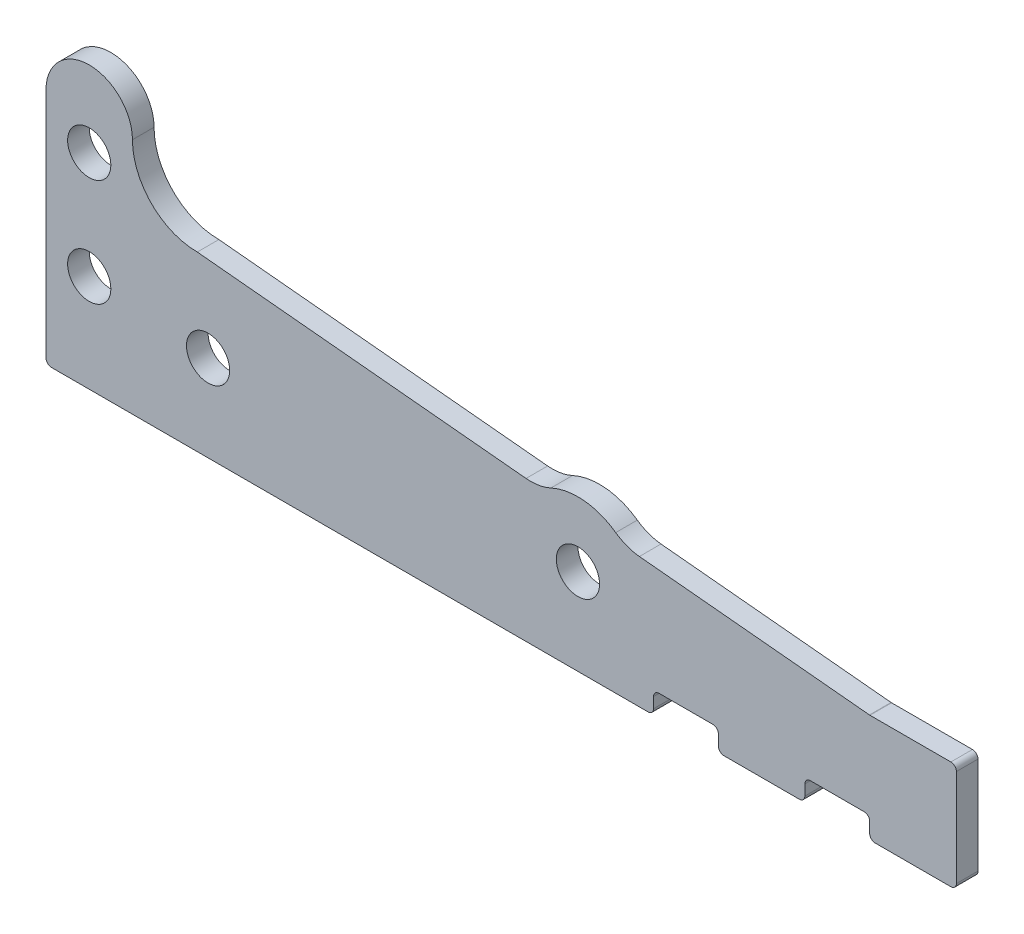
from build123d import *

# Parameters (mm, degrees)
SKETCH1_R           = 1.5875
BOSS_EXTRUDE1_DEPTH = 1.5875
FILLET1_R           = 0.4064
FILLET2_R           = 3.571875


with BuildPart() as part:
    # Sketch1 → Boss-Extrude1 (new body)
    with BuildSketch(Plane.XY):
        with BuildLine():
            Line((0, -1.5875), (44.63290286, -1.5875))
            Line((44.63290286, -1.5875), (44.63290286, 0))
            Line((44.63290286, 0), (49.39540286, 0))
            Line((49.39540286, 0), (49.39540286, -1.5875))
            Line((49.39540286, -1.5875), (55.74540286, -1.5875))
            Line((55.74540286, -1.5875), (55.74540286, 0))
            Line((55.74540286, 0), (60.50790286, 0))
            Line((60.50790286, 0), (60.50790286, -1.5875))
            Line((60.50790286, -1.5875), (66.87666203, -1.5875))
            Line((66.87666203, -1.5875), (66.87666203, 6.35))
            Line((66.87666203, 6.35), (60.50790286, 6.35))
            Line((60.50790286, 6.35), (42.486240722, 8.087573964))
            ThreePointArc((42.486240722, 8.087573964), (39.53371386, 9.503017007), (36.365146493, 8.677744497))
            Line((36.365146493, 8.677744497), (11.1125, 11.1125))
            ThreePointArc((11.1125, 11.1125), (7.744903955, 12.507403955), (6.35, 15.875))
            ThreePointArc((6.35, 15.875), (3.175, 19.05), (0, 15.875))
            Line((0, 15.875), (0, -1.5875))
        make_face()
        with Locations((3.175, 5.588)):
            Circle(SKETCH1_R, mode=Mode.SUBTRACT)
        with Locations((3.175, 13.462)):
            Circle(SKETCH1_R, mode=Mode.SUBTRACT)
        with Locations((11.90625, 4.7625)):
            Circle(SKETCH1_R, mode=Mode.SUBTRACT)
        with Locations((39.07665286, 4.7625)):
            Circle(SKETCH1_R, mode=Mode.SUBTRACT)
    extrude(amount=BOSS_EXTRUDE1_DEPTH)

    # Fillet1
    fillet1_edges = [part.edges().sort_by_distance(p)[0] for p in [
        (60.50790286, 6.35, 0.79375),
        (66.87666203, 6.35, 0.79375),
        (66.87666203, -1.5875, 0.79375),
        (60.50790286, -1.5875, 0.79375),
        (60.50790286, 0, 0.79375),
        (55.74540286, 0, 0.79375),
        (55.74540286, -1.5875, 0.79375),
        (49.39540286, -1.5875, 0.79375),
        (49.39540286, 0, 0.79375),
        (44.63290286, 0, 0.79375),
        (44.63290286, -1.5875, 0.79375),
        (0, -1.5875, 0.79375),
    ]]
    fillet(fillet1_edges, radius=FILLET1_R)

    # Fillet2
    fillet2_edges = [part.edges().sort_by_distance(p)[0] for p in [
        (36.365146493, 8.677744497, 0.79375),
        (42.486240722, 8.087573964, 0.79375),
    ]]
    fillet(fillet2_edges, radius=FILLET2_R)


solid = part.part
